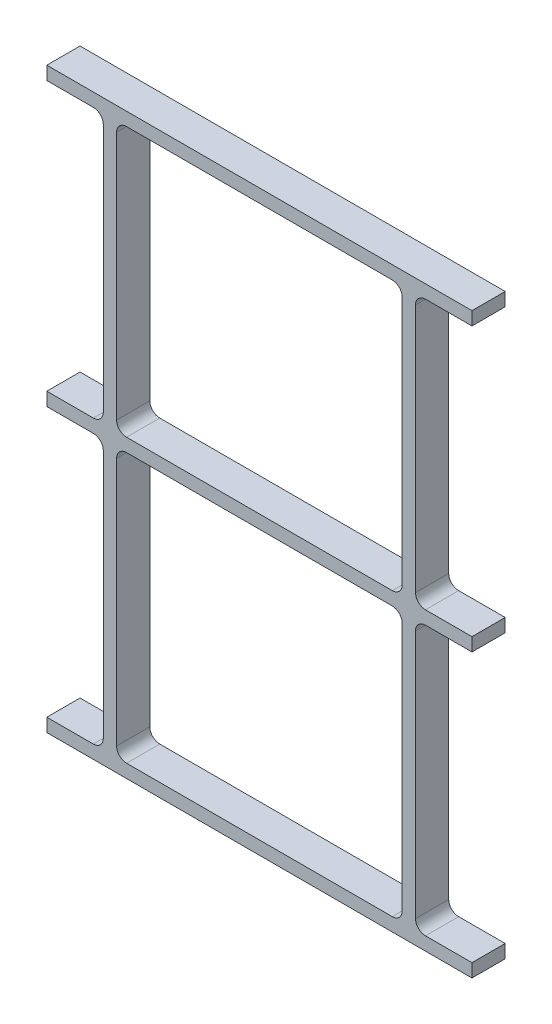
from build123d import *

# Parameters (mm, degrees)
SKETCH1_W           = 86
SKETCH1_H           = 81
BOSS_EXTRUDE1_DEPTH = 10
FILLET1_R           = 3


with BuildPart() as part:
    # Sketch1 → Boss-Extrude1 (new body)
    with BuildSketch(Plane.XY):
        Polygon((-64, 129.5), (-64, 125.5), (-47, 125.5), (-47, 44.5), (-64, 44.5), (-64, 40.5), (-47, 40.5), (-47, -40.5), (-64, -40.5), (-64, -44.5), (0, -44.5), (64, -44.5), (64, -40.5), (47, -40.5), (47, 40.5), (64, 40.5), (64, 44.5), (47, 44.5), (47, 125.5), (64, 125.5), (64, 129.5), (0, 129.5), align=None)
        Rectangle(SKETCH1_W, SKETCH1_H, mode=Mode.SUBTRACT)
        with Locations((0, 85)):
            Rectangle(SKETCH1_W, SKETCH1_H, mode=Mode.SUBTRACT)
    extrude(amount=BOSS_EXTRUDE1_DEPTH)

    # Fillet1
    fillet1_edges = [part.edges().sort_by_distance(p)[0] for p in [
        (-43, -40.5, 5),
        (43, -40.5, 5),
        (43, 40.5, 5),
        (-43, 40.5, 5),
        (-47, 44.5, 5),
        (-47, 125.5, 5),
        (47, 125.5, 5),
        (47, 44.5, 5),
        (47, 40.5, 5),
        (47, -40.5, 5),
        (-47, -40.5, 5),
        (-47, 40.5, 5),
        (43, 44.5, 5),
        (43, 125.5, 5),
        (-43, 125.5, 5),
        (-43, 44.5, 5),
    ]]
    fillet(fillet1_edges, radius=FILLET1_R)


solid = part.part
